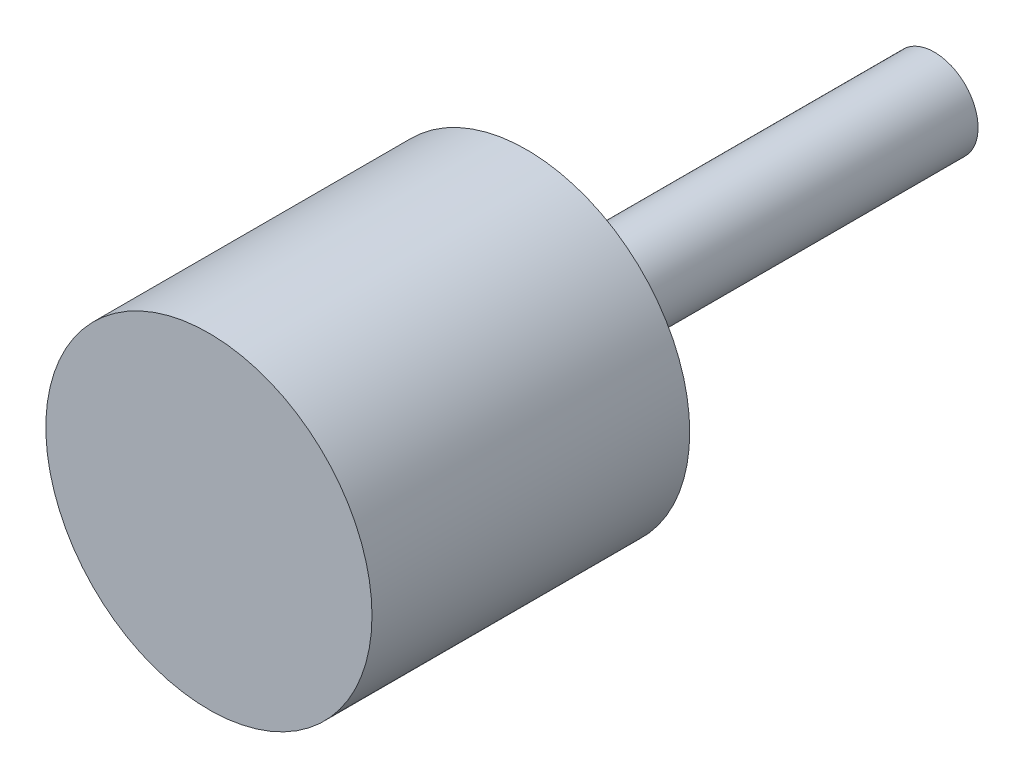
from build123d import *

# Parameters (mm, degrees)
SKETCH1_R      = 3.11
EXTRUDE1_DEPTH = 29
SKETCH2_R      = 11.6
EXTRUDE2_DEPTH = 22.6


with BuildPart() as part:
    # Sketch1 → Extrude1 (new body)
    with BuildSketch(Plane.XY):
        with Locations(Location((0, 0, 0), (0, 0, 180))):
            Circle(SKETCH1_R)
    extrude(amount=EXTRUDE1_DEPTH)

    # Sketch2 → Extrude2 (add)
    with BuildSketch(Plane.XY.offset(29)):
        Circle(SKETCH2_R)
    extrude(amount=EXTRUDE2_DEPTH)


solid = part.part
